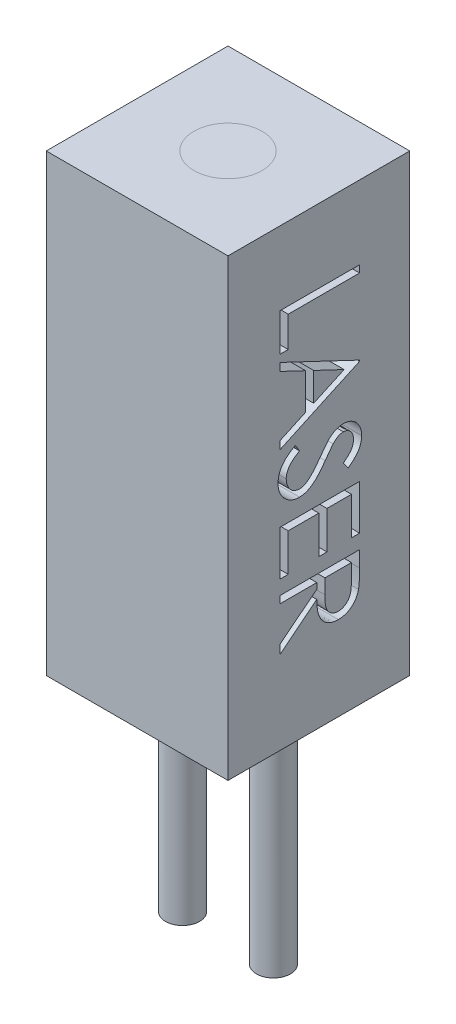
from build123d import *

# Parameters (mm, degrees)
SKETCH1_W           = 8
SKETCH1_H           = 20
BOSS_EXTRUDE1_DEPTH = 8
SKETCH2_R           = 0.75
BOSS_EXTRUDE2_DEPTH = 10
CUT_EXTRUDE1_DEPTH  = 1


with BuildPart() as part:
    # Sketch1 → Boss-Extrude1 (new body)
    with BuildSketch(Plane.XY):
        with Locations((0, 10)):
            Rectangle(SKETCH1_W, SKETCH1_H)
    extrude(amount=BOSS_EXTRUDE1_DEPTH)

    # Sketch2 → Boss-Extrude2 (add)
    with BuildSketch(Plane.XZ):
        with Locations(Location((-2, 4, 0), (0, 0, 180))):
            Circle(SKETCH2_R)
        with Locations(Location((2, 4, 0), (0, 0, 180))):
            Circle(SKETCH2_R)
    extrude(amount=BOSS_EXTRUDE2_DEPTH)

    # Sketch4 → Cut-Extrude1 (cut)
    # profile 1 of 5: a face of its own
    with BuildSketch(Plane(origin=(4, 0, 0), x_dir=(0, 0, -1), z_dir=(1, 0, 0))):
        Polygon((-2.207218495, 16.764460515), (-2.207218495, 16.45035795), (-5.348244136, 16.45035795), (-5.348244136, 15.104204104), (-5.707218495, 15.104204104), (-5.707218495, 16.764460515), align=None)
    # profile 2 of 5: a face of its own
    with BuildSketch(Plane(origin=(4, 0, 0), x_dir=(0, 0, -1), z_dir=(1, 0, 0))):
        Polygon((-2.207218495, 13.084973335), (-5.707218495, 11.46958872), (-5.707218495, 11.811035034), (-4.585423623, 12.328462918), (-4.585423623, 13.91510154), (-5.707218495, 14.447252983), (-5.707218495, 14.79010154), (-2.207218495, 13.12984513), align=None)
        Polygon((-2.889410001, 13.110914841), (-4.226449264, 13.744728944), (-4.226449264, 12.493927662), align=None, mode=Mode.SUBTRACT)
    # profile 3 of 5: a face of its own
    with BuildSketch(Plane(origin=(4, 0, 0), x_dir=(0, 0, -1), z_dir=(1, 0, 0))):
        with BuildLine():
            Line((-5.032038206, 11.29010154), (-4.854654392, 10.994228143))
            add(Edge.make_bspline(
                [(-4.854654392, 10.994228143), (-4.900718777, 10.966709906), (-4.988976361, 10.913986025), (-5.108234402, 10.826034666), (-5.209596558, 10.734901755), (-5.292473166, 10.639912421), (-5.357722053, 10.541646473), (-5.403924284, 10.439462419), (-5.43274026, 10.333704608), (-5.436240346, 10.261730787), (-5.437987726, 10.225798656)],
                knots=[0, 0, 0, 0, 1.272034388, 2.437168799, 3.508375237, 4.49857839, 5.41946034, 6.295179144, 7.148887113, 8, 8, 8, 8], degree=3))
            add(Edge.make_bspline(
                [(-5.437987726, 10.225798656), (-5.437133054, 10.195111792), (-5.435438666, 10.134275013), (-5.419157848, 10.044712816), (-5.394145779, 9.957730839), (-5.358324626, 9.875122856), (-5.31498694, 9.798024874), (-5.26263795, 9.730426499), (-5.204041723, 9.671950863), (-5.138622778, 9.624249118), (-5.068509865, 9.587217944), (-4.995898504, 9.560421162), (-4.92110809, 9.543366622), (-4.870402446, 9.541195921), (-4.844838687, 9.54010154)],
                knots=[0, 0, 0, 0, 1.095270387, 2.171376115, 3.241375676, 4.322296363, 5.380636668, 6.392615365, 7.366724986, 8.328592944, 9.273498763, 10.190095884, 11.087518669, 12, 12, 12, 12], degree=3))
            add(Edge.make_bspline(
                [(-4.844838687, 9.54010154), (-4.815697837, 9.541575851), (-4.756458748, 9.544572909), (-4.669059095, 9.569904389), (-4.582566525, 9.609753636), (-4.52906526, 9.64651628), (-4.501289008, 9.665602341)],
                knots=[0, 0, 0, 0, 0.938893495, 1.908633276, 2.914225137, 4, 4, 4, 4], degree=3))
            add(Edge.make_bspline(
                [(-4.501289008, 9.665602341), (-4.481201204, 9.681228593), (-4.438905581, 9.714130248), (-4.377000111, 9.771476936), (-4.311584269, 9.837018657), (-4.242923693, 9.911083073), (-4.172272296, 9.995142431), (-4.098157344, 10.087470673), (-4.02080158, 10.188545745), (-3.969646968, 10.259778888), (-3.943196059, 10.296611957)],
                knots=[0, 0, 0, 0, 0.72226686, 1.520759855, 2.393439377, 3.351307446, 4.386958158, 5.510256019, 6.712608938, 8, 8, 8, 8], degree=3))
            add(Edge.make_bspline(
                [(-3.943196059, 10.296611957), (-3.916961468, 10.333431041), (-3.866802928, 10.403826326), (-3.792456256, 10.50234841), (-3.724049103, 10.59033072), (-3.662534356, 10.66822157), (-3.605229053, 10.734005824), (-3.555204437, 10.790088371), (-3.509789253, 10.834400114), (-3.480351283, 10.859058553), (-3.46713436, 10.870129585)],
                knots=[0, 0, 0, 0, 1.452255772, 2.776602448, 3.96446981, 5.032613149, 5.964194703, 6.766668629, 7.446264616, 8, 8, 8, 8], degree=3))
            add(Edge.make_bspline(
                [(-3.46713436, 10.870129585), (-3.446533323, 10.88560213), (-3.40601862, 10.916030967), (-3.342693762, 10.956196972), (-3.277870496, 10.990336135), (-3.211374632, 11.017098467), (-3.144139703, 11.039634686), (-3.075288457, 11.054792617), (-3.005129839, 11.064284014), (-2.957916338, 11.065256), (-2.934281796, 11.065742566)],
                knots=[0, 0, 0, 0, 1.068054152, 2.10047183, 3.106115577, 4.101338837, 5.06977816, 6.043150881, 7.020423561, 8, 8, 8, 8], degree=3))
            add(Edge.make_bspline(
                [(-2.934281796, 11.065742566), (-2.897248921, 11.06444305), (-2.823974723, 11.061871795), (-2.716988875, 11.039948674), (-2.614534248, 11.005750054), (-2.518867604, 10.956288835), (-2.430212661, 10.895136456), (-2.349923921, 10.822863949), (-2.281852992, 10.737056255), (-2.223067826, 10.642383672), (-2.176654479, 10.539425975), (-2.141456884, 10.431731992), (-2.121779272, 10.318829481), (-2.118923792, 10.242229844), (-2.117474905, 10.203362758)],
                knots=[0, 0, 0, 0, 1.005541892, 1.989591032, 2.955705311, 3.932863626, 4.905387107, 5.876519979, 6.856563935, 7.871847665, 8.897921447, 9.918317993, 10.943742853, 12, 12, 12, 12], degree=3))
            add(Edge.make_bspline(
                [(-2.117474905, 10.203362758), (-2.118870809, 10.16211251), (-2.121639052, 10.080308335), (-2.146570068, 9.959752288), (-2.186841553, 9.843458517), (-2.233224535, 9.749847729), (-2.279342426, 9.676710603), (-2.321365246, 9.620938837), (-2.369739465, 9.564421099), (-2.424598974, 9.506703129), (-2.486445647, 9.448762444), (-2.554856359, 9.389739), (-2.629412908, 9.329494729), (-2.68263741, 9.290738869), (-2.709922822, 9.270870771)],
                knots=[0, 0, 0, 0, 1.286821612, 2.551921131, 3.825787379, 5.12137259, 5.803616487, 6.523126609, 7.299589446, 8.125436757, 9.008162487, 9.944516264, 10.946261234, 12, 12, 12, 12], degree=3))
            Line((-2.709922822, 9.270870771), (-2.925167213, 9.554825098))
            add(Edge.make_bspline(
                [(-2.925167213, 9.554825098), (-2.903078522, 9.57197103), (-2.860540867, 9.604990087), (-2.80096956, 9.655119576), (-2.746553053, 9.702368215), (-2.699288016, 9.748918644), (-2.656585584, 9.792312181), (-2.620026809, 9.834429536), (-2.589248025, 9.874662872), (-2.556417774, 9.92538402), (-2.523667169, 9.989269582), (-2.496544076, 10.069385335), (-2.479658062, 10.15288042), (-2.477530621, 10.209592609), (-2.476449264, 10.238418848)],
                knots=[0, 0, 0, 0, 1.181667846, 2.275615987, 3.290305621, 4.226321945, 5.078535498, 5.862783384, 6.581873284, 7.217493746, 8.414623899, 9.604724551, 10.782505457, 12, 12, 12, 12], degree=3))
            add(Edge.make_bspline(
                [(-2.476449264, 10.238418848), (-2.477660964, 10.27457537), (-2.479997613, 10.344299818), (-2.505517599, 10.443290054), (-2.545699459, 10.532383979), (-2.602014437, 10.608936544), (-2.66873543, 10.672673521), (-2.745514285, 10.71877898), (-2.830296687, 10.746529144), (-2.889438344, 10.749915424), (-2.919558238, 10.751640002)],
                knots=[0, 0, 0, 0, 1.14458467, 2.207223713, 3.21896685, 4.227309161, 5.202851033, 6.127160689, 7.046193047, 8, 8, 8, 8], degree=3))
            add(Edge.make_bspline(
                [(-2.919558238, 10.751640002), (-2.938304936, 10.751228574), (-2.975828986, 10.750405045), (-3.031413624, 10.739694171), (-3.086504856, 10.724506475), (-3.141347651, 10.702278345), (-3.197232227, 10.672338053), (-3.254007703, 10.631628257), (-3.313107523, 10.580698625), (-3.351507673, 10.54160905), (-3.371781796, 10.520970931)],
                knots=[0, 0, 0, 0, 0.858526328, 1.718456515, 2.587092892, 3.476767204, 4.426280253, 5.487868114, 6.673670035, 8, 8, 8, 8], degree=3))
            add(Edge.make_bspline(
                [(-3.371781796, 10.520970931), (-3.378618822, 10.513309559), (-3.39486203, 10.495107892), (-3.421454311, 10.461831966), (-3.454257083, 10.417889168), (-3.4948444, 10.364426967), (-3.541925862, 10.300459605), (-3.594899474, 10.225980049), (-3.655484933, 10.141818516), (-3.697842474, 10.0820966), (-3.720239328, 10.050518207)],
                knots=[0, 0, 0, 0, 0.420754252, 0.999615792, 1.744751191, 2.668019286, 3.750313428, 4.999500688, 6.413464383, 8, 8, 8, 8], degree=3))
            add(Edge.make_bspline(
                [(-3.720239328, 10.050518207), (-3.747880688, 10.012532294), (-3.80140435, 9.938977837), (-3.88182003, 9.834320257), (-3.960467798, 9.739426449), (-4.036845405, 9.653963246), (-4.110373498, 9.577086337), (-4.181936679, 9.509648616), (-4.251022251, 9.450962936), (-4.339594827, 9.387783718), (-4.448375911, 9.323225898), (-4.58165415, 9.267784391), (-4.71545047, 9.232826043), (-4.805377307, 9.228254528), (-4.84974654, 9.225998976)],
                knots=[0, 0, 0, 0, 1.163667725, 2.253281268, 3.268753668, 4.215851969, 5.092017293, 5.902905408, 6.650798638, 7.335211899, 8.59617414, 9.77448103, 10.901945474, 12, 12, 12, 12], degree=3))
            add(Edge.make_bspline(
                [(-4.84974654, 9.225998976), (-4.881124657, 9.226656479), (-4.943271551, 9.227958717), (-5.034530225, 9.242914323), (-5.123147717, 9.264853731), (-5.208108932, 9.297817027), (-5.290550721, 9.338364995), (-5.369713681, 9.388447555), (-5.444509566, 9.44882205), (-5.516494873, 9.515925856), (-5.5815183, 9.590500487), (-5.639674473, 9.669132298), (-5.688350825, 9.752331777), (-5.727535414, 9.839696228), (-5.758667772, 9.930742369), (-5.781045061, 10.025566015), (-5.794810425, 10.124431223), (-5.796236858, 10.191632297), (-5.796962085, 10.225798656)],
                knots=[0, 0, 0, 0, 0.983610584, 1.948120116, 2.894308362, 3.843560551, 4.801159957, 5.773581695, 6.77566113, 7.813174769, 8.857584665, 9.875476876, 10.877851407, 11.875574773, 12.875048225, 13.892438445, 14.928473903, 16, 16, 16, 16], degree=3))
            add(Edge.make_bspline(
                [(-5.796962085, 10.225798656), (-5.796445046, 10.252232832), (-5.79541748, 10.304768273), (-5.786548348, 10.382265971), (-5.773541659, 10.458340575), (-5.753711169, 10.532036879), (-5.72908485, 10.604272534), (-5.698933485, 10.674403654), (-5.663039818, 10.742600626), (-5.621344397, 10.808943086), (-5.573291894, 10.87405617), (-5.517760226, 10.937606061), (-5.455132961, 11.000319777), (-5.384767843, 11.061047679), (-5.307416652, 11.120909139), (-5.222431258, 11.178790927), (-5.130252828, 11.235871685), (-5.065387895, 11.271687289), (-5.032038206, 11.29010154)],
                knots=[0, 0, 0, 0, 0.915384692, 1.819241058, 2.699029451, 3.586605375, 4.459625921, 5.340865773, 6.228072412, 7.126546901, 8.052715223, 9.028303326, 10.047266019, 11.120332924, 12.245748783, 13.433636234, 14.680528497, 16, 16, 16, 16], degree=3))
        make_face()
    # profile 4 of 5: a face of its own
    with BuildSketch(Plane(origin=(4, 0, 0), x_dir=(0, 0, -1), z_dir=(1, 0, 0))):
        Polygon((-2.207218495, 8.508050258), (-2.207218495, 6.533691284), (-2.566192854, 6.533691284), (-2.566192854, 8.193947694), (-3.643115931, 8.193947694), (-3.643115931, 6.533691284), (-4.00209029, 6.533691284), (-4.00209029, 8.193947694), (-5.348244136, 8.193947694), (-5.348244136, 6.533691284), (-5.707218495, 6.533691284), (-5.707218495, 8.508050258), align=None)
    # profile 5 of 5: a face of its own
    with BuildSketch(Plane(origin=(4, 0, 0), x_dir=(0, 0, -1), z_dir=(1, 0, 0))):
        with BuildLine():
            Line((-2.207218495, 5.905486156), (-2.207218495, 5.205065483))
            add(Edge.make_bspline(
                [(-2.207218495, 5.205065483), (-2.207374081, 5.158324354), (-2.207672823, 5.06857621), (-2.209338586, 4.940002939), (-2.214112942, 4.823175842), (-2.218221525, 4.718156003), (-2.225713467, 4.624945348), (-2.232874114, 4.543258057), (-2.242247775, 4.47347036), (-2.250953197, 4.431224508), (-2.254894777, 4.412096733)],
                knots=[0, 0, 0, 0, 1.410062039, 2.707475311, 3.878576406, 4.937260626, 5.877586885, 6.699081471, 7.410979367, 8, 8, 8, 8], degree=3))
            add(Edge.make_bspline(
                [(-2.254894777, 4.412096733), (-2.261220825, 4.386489657), (-2.273737968, 4.335821775), (-2.300207982, 4.262878253), (-2.33078919, 4.193339788), (-2.366986748, 4.127467337), (-2.408169292, 4.06525479), (-2.454577437, 4.006795296), (-2.506447521, 3.952423084), (-2.562455, 3.901719788), (-2.623088558, 3.855758881), (-2.687464928, 3.81598573), (-2.755181472, 3.781928181), (-2.826474005, 3.754739014), (-2.900739865, 3.732866164), (-2.978627535, 3.717438512), (-3.059788821, 3.708187715), (-3.115146687, 3.707245805), (-3.143216091, 3.706768207)],
                knots=[0, 0, 0, 0, 1.02737288, 2.032829108, 3.019628684, 3.985738875, 4.958353778, 5.924249254, 6.890702889, 7.883913451, 8.865824512, 9.85161466, 10.829249435, 11.81541824, 12.821369441, 13.843154991, 14.906364023, 16, 16, 16, 16], degree=3))
            add(Edge.make_bspline(
                [(-3.143216091, 3.706768207), (-3.189851249, 3.708237167), (-3.280848522, 3.711103488), (-3.412908654, 3.737829124), (-3.536100709, 3.781603697), (-3.650253249, 3.84193416), (-3.753201269, 3.918727084), (-3.843318041, 4.011014716), (-3.91942576, 4.11832575), (-3.971642364, 4.218694305), (-4.005240765, 4.307396689), (-4.028999397, 4.380636359), (-4.047046374, 4.460589123), (-4.063448554, 4.546107937), (-4.075964736, 4.637853357), (-4.084853603, 4.735640631), (-4.090569212, 4.83971433), (-4.091404287, 4.911054092), (-4.091833879, 4.947753784)],
                knots=[0, 0, 0, 0, 1.260402266, 2.459371274, 3.627181936, 4.786749125, 5.93865593, 7.087644312, 8.261344208, 9.485713728, 10.136162886, 10.825977872, 11.566646758, 12.35154167, 13.181268117, 14.0701832, 15.007234106, 16, 16, 16, 16], degree=3))
            Line((-4.091833879, 4.947753784), (-5.707218495, 3.661896412))
            Line((-5.707218495, 3.661896412), (-5.707218495, 4.050317886))
            Line((-5.707218495, 4.050317886), (-4.091833879, 5.336175258))
            Line((-4.091833879, 5.336175258), (-4.091833879, 5.591383591))
            Line((-4.091833879, 5.591383591), (-5.707218495, 5.591383591))
            Line((-5.707218495, 5.591383591), (-5.707218495, 5.905486156))
            Line((-5.707218495, 5.905486156), (-2.207218495, 5.905486156))
        make_face()
        with BuildLine():
            Line((-2.566192854, 5.591383591), (-3.732859521, 5.591383591))
            Line((-3.732859521, 5.591383591), (-3.737767373, 4.950558271))
            add(Edge.make_bspline(
                [(-3.737767373, 4.950558271), (-3.73778061, 4.920638232), (-3.737806266, 4.862644675), (-3.733812491, 4.778744009), (-3.729269168, 4.700623903), (-3.722319837, 4.628583132), (-3.713363717, 4.562589619), (-3.702160891, 4.502676001), (-3.689108315, 4.448745617), (-3.668908852, 4.385844265), (-3.636888213, 4.31562675), (-3.590380059, 4.239220707), (-3.531504434, 4.174375533), (-3.465251069, 4.118466425), (-3.390908682, 4.075402173), (-3.311777052, 4.044058953), (-3.228539348, 4.024389335), (-3.171367504, 4.022050896), (-3.142514969, 4.020870771)],
                knots=[0, 0, 0, 0, 1.14660753, 2.222451964, 3.218720504, 4.145691244, 4.995719623, 5.770487122, 6.480909919, 7.121111896, 8.299844659, 9.430703709, 10.534634535, 11.641396424, 12.741395289, 13.810956493, 14.895269934, 16, 16, 16, 16], degree=3))
            add(Edge.make_bspline(
                [(-3.142514969, 4.020870771), (-3.11436059, 4.022054523), (-3.058568884, 4.024400289), (-2.977115447, 4.044097063), (-2.899688586, 4.075904475), (-2.827764107, 4.120505827), (-2.761932115, 4.17439972), (-2.706383198, 4.238406732), (-2.659864217, 4.309303391), (-2.630354074, 4.375613613), (-2.612225524, 4.434841769), (-2.59948436, 4.486273875), (-2.589161512, 4.544608645), (-2.581135692, 4.609706277), (-2.573913371, 4.681448998), (-2.56923061, 4.760033254), (-2.566400348, 4.845368296), (-2.566263628, 4.904515479), (-2.566192854, 4.935133591)],
                knots=[0, 0, 0, 0, 1.100801541, 2.181386982, 3.260112282, 4.364594493, 5.481957178, 6.577424609, 7.668452592, 8.790448866, 9.403819393, 10.091598921, 10.863153553, 11.720938239, 12.658472417, 13.685008818, 14.801622349, 16, 16, 16, 16], degree=3))
            Line((-2.566192854, 4.935133591), (-2.566192854, 5.591383591))
        make_face(mode=Mode.SUBTRACT)
    extrude(amount=-CUT_EXTRUDE1_DEPTH, mode=Mode.SUBTRACT)


solid = part.part
